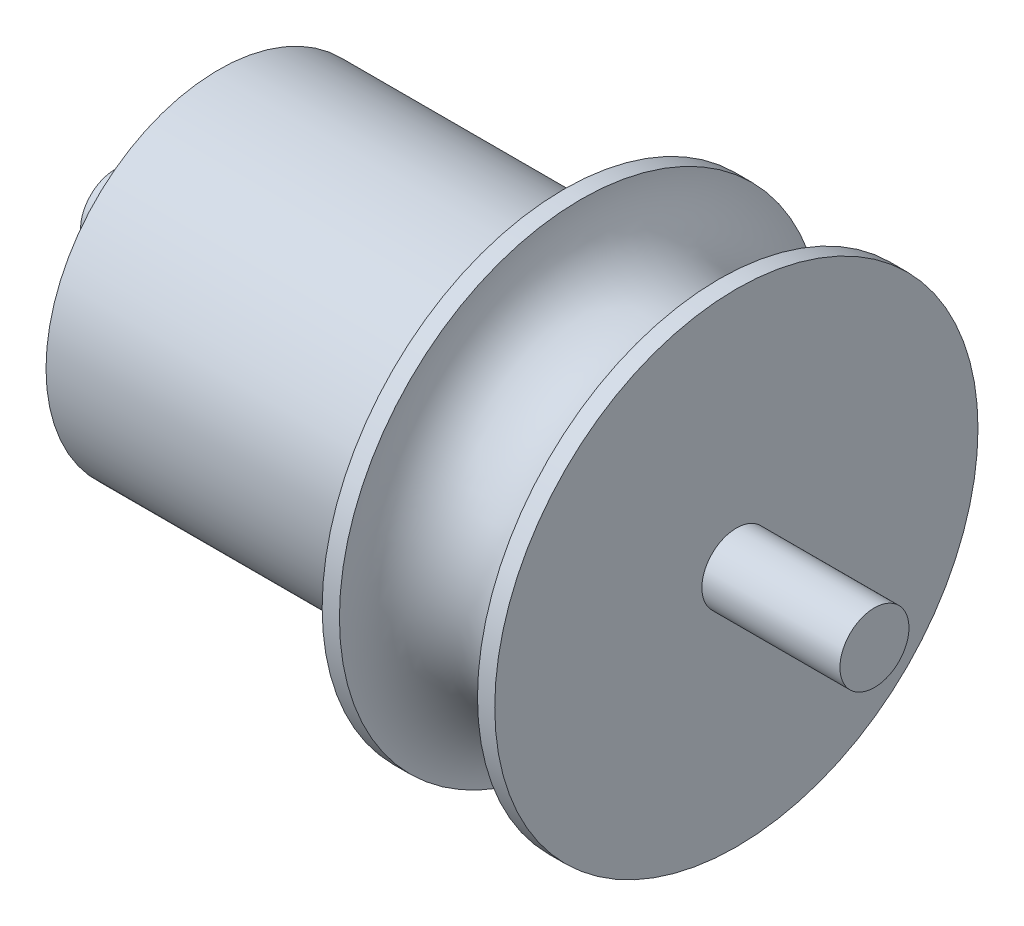
from build123d import *

# Parameters (mm, degrees)
BOSS_EXTRUDE3_DEPTH      = 20
BOSS_EXTRUDE3_DEPTH_BACK = 90
SKETCH5_R                = 5


with BuildPart() as part:
    # Sketch4 → Revolve1 (revolve)
    with BuildSketch(Plane.XY, mode=Mode.PRIVATE) as revolve1_sk:
        with BuildLine():
            Line((0, 0), (75, 0))
            Line((75, 0), (75, 35))
            Line((75, 35), (72.5, 35))
            ThreePointArc((72.5, 35), (62.5, 25), (52.5, 35))
            Line((52.5, 35), (50, 35))
            Line((50, 35), (50, 25))
            Line((50, 25), (0, 25))
            Line((0, 25), (0, 0))
        make_face()
    revolve(revolve1_sk.sketch.rotate(Axis((0, 0, 0), (1, 0, 0)), 90), axis=Axis((0, 0, 0), (1, 0, 0)))

    # Sketch5 → Boss-Extrude3 (add, two sides: drawn at the far end of the back side and taken through both)
    with BuildSketch(Plane(origin=(75, 0, 0), x_dir=(0, 0, -1), z_dir=(1, 0, 0)).offset(-BOSS_EXTRUDE3_DEPTH_BACK)):
        Circle(SKETCH5_R)
    extrude(amount=BOSS_EXTRUDE3_DEPTH + BOSS_EXTRUDE3_DEPTH_BACK)


solid = part.part
